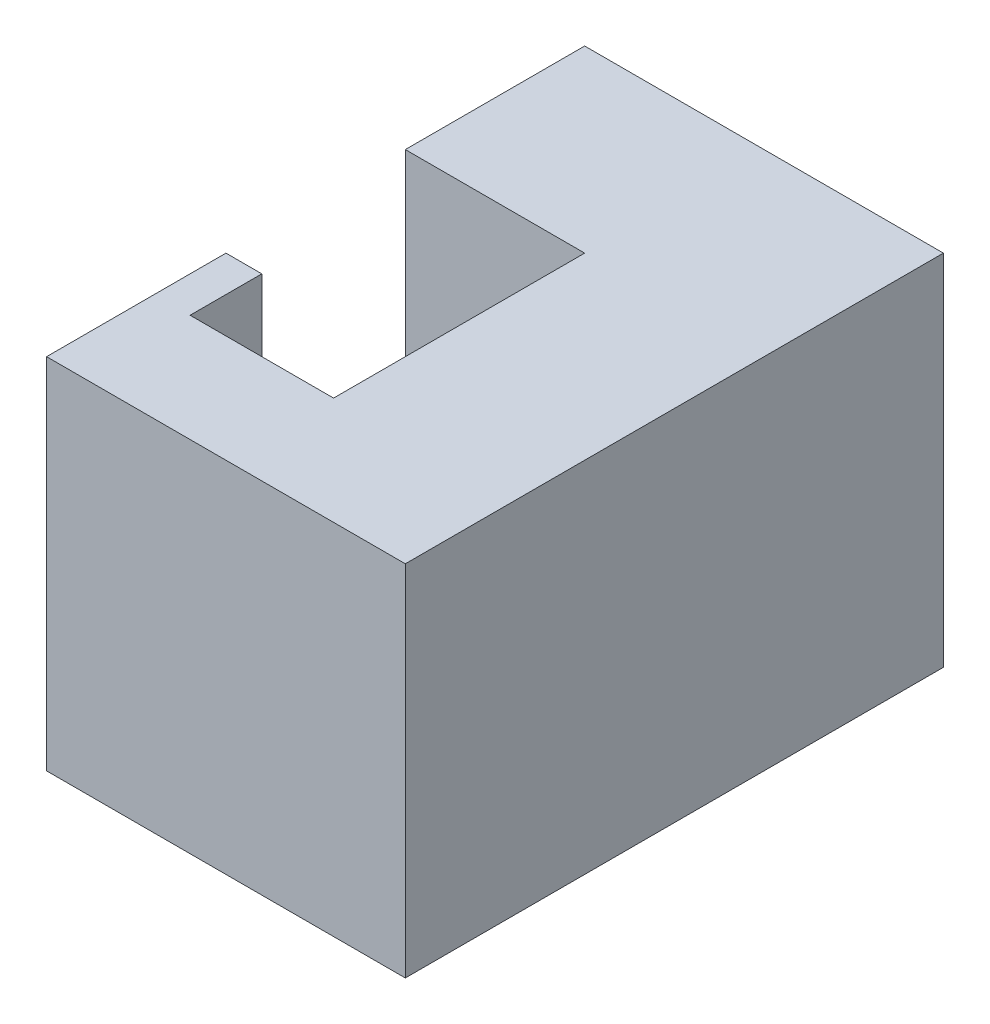
from build123d import *

# Parameters (mm, degrees)
SKETCH2_W               = 5
SKETCH2_H               = 7.5
BOSS_EXTRUDE1_DEPTH     = 5
CUT_EXTRUDE1_DEPTH      = 7.731456009
CUT_EXTRUDE1_DEPTH_BACK = 5


with BuildPart() as part:
    # Sketch2 → Boss-Extrude1 (new body)
    with BuildSketch(Plane(origin=(0, 0, 0), x_dir=(1, 0, 0), z_dir=(0, 1, 0))):
        Rectangle(SKETCH2_W, SKETCH2_H)
    extrude(amount=BOSS_EXTRUDE1_DEPTH)

    # Sketch3 → Cut-Extrude1 (cut, two sides: drawn at the far end of the back side and taken through both)
    with BuildSketch(Plane.XZ.offset(-CUT_EXTRUDE1_DEPTH_BACK)):
        Polygon((-26.642135624, -1.25), (-2.5, -1.25), (0, -1.25), (0, 2.25), (-2, 2.25), (-2, 1.25), (-2.5, 1.25), (-26.642135624, 1.25), (-74.926406871, 1.25), (-74.926406871, -1.25), align=None)
    extrude(amount=CUT_EXTRUDE1_DEPTH + CUT_EXTRUDE1_DEPTH_BACK, mode=Mode.SUBTRACT)


solid = part.part
